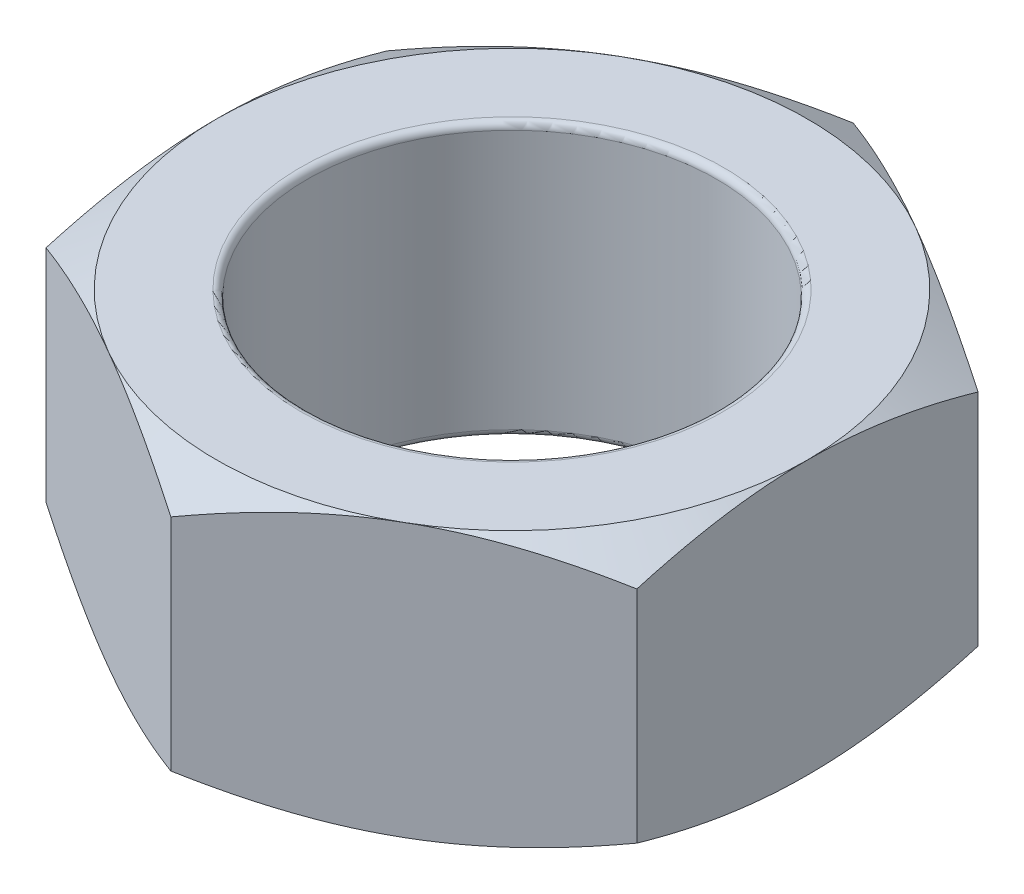
from build123d import *

# Parameters (mm, degrees)
SKETCH1_R           = 1.5
BOSS_EXTRUDE1_DEPTH = 2
SKETCH2_OUTSIDE_W   = 14.64
SKETCH2_OUTSIDE_H   = 15.31
SKETCH2_OUTSIDE_R   = 2.165063509
CUT_EXTRUDE1_DEPTH  = 2
CUT_EXTRUDE1_DRAFT  = -60
SKETCH3_OUTSIDE_W   = 14.64
SKETCH3_OUTSIDE_H   = 15.31
SKETCH3_OUTSIDE_R   = 2.165063509
CUT_EXTRUDE2_DEPTH  = 2
CUT_EXTRUDE2_DRAFT  = -60
FILLET1_R           = 0.05


with BuildPart() as part:
    # Sketch1 → Boss-Extrude1 (new body)
    with BuildSketch(Plane(origin=(0, 0, 0), x_dir=(1, 0, 0), z_dir=(0, 1, 0))):
        Polygon((0, 2.5), (-2.165063509, 1.25), (-2.165063509, -1.25), (0, -2.5), (2.165063509, -1.25), (2.165063509, 1.25), align=None)
        with Locations(Location((0, 0, 0), (0, 0, 270))):
            Circle(SKETCH1_R, mode=Mode.SUBTRACT)
    extrude(amount=BOSS_EXTRUDE1_DEPTH)


with BuildPart() as cut_extrude1_tool:
    # Sketch2 outside → Cut-Extrude1 (with draft: the straight prism first)
    with BuildSketch(Plane(origin=(0, 2, 0), x_dir=(1, 0, 0), z_dir=(0, 1, 0))):
        Rectangle(SKETCH2_OUTSIDE_W, SKETCH2_OUTSIDE_H)
        Circle(SKETCH2_OUTSIDE_R, mode=Mode.SUBTRACT)
    extrude(amount=-CUT_EXTRUDE1_DEPTH)
    # Cut-Extrude1: the draft: its side faces are tilted about the plane it starts from
    cut_extrude1_sides = [cut_extrude1_tool.faces().sort_by_distance(p)[0] for p in [
        (0, 1, 7.655),
        (7.32, 1, 0),
        (0, 1, -7.655),
        (-7.32, 1, 0),
        (-2.165063509, 1, 0),
    ]]
    draft(cut_extrude1_sides, Plane(origin=(0, 2, 0), x_dir=(1, 0, 0), z_dir=(0, 1, 0)), CUT_EXTRUDE1_DRAFT)


with BuildPart() as part_1:
    add(part.part)

    # Cut-Extrude1: cut by cut_extrude1_tool
    add(cut_extrude1_tool.part, mode=Mode.SUBTRACT)


with BuildPart() as cut_extrude2_tool:
    # Sketch3 outside → Cut-Extrude2 (with draft: the straight prism first)
    with BuildSketch(Plane.XZ):
        Rectangle(SKETCH3_OUTSIDE_W, SKETCH3_OUTSIDE_H)
        Circle(SKETCH3_OUTSIDE_R, mode=Mode.SUBTRACT)
    extrude(amount=-CUT_EXTRUDE2_DEPTH)
    # Cut-Extrude2: the draft: its side faces are tilted about the plane it starts from
    cut_extrude2_sides = [cut_extrude2_tool.faces().sort_by_distance(p)[0] for p in [
        (0, 1, -7.655),
        (7.32, 1, 0),
        (0, 1, 7.655),
        (-7.32, 1, 0),
        (-2.165063509, 1, 0),
    ]]
    draft(cut_extrude2_sides, Plane.XZ, CUT_EXTRUDE2_DRAFT)


with BuildPart() as part_2:
    add(part_1.part)

    # Cut-Extrude2: cut by cut_extrude2_tool
    add(cut_extrude2_tool.part, mode=Mode.SUBTRACT)

    # Fillet1
    fillet1_edges = [part_2.edges().sort_by_distance(p)[0] for p in [
        (0, 0, -1.5),
        (0, 2, -1.5),
    ]]
    fillet(fillet1_edges, radius=FILLET1_R)


solid = part_2.part
